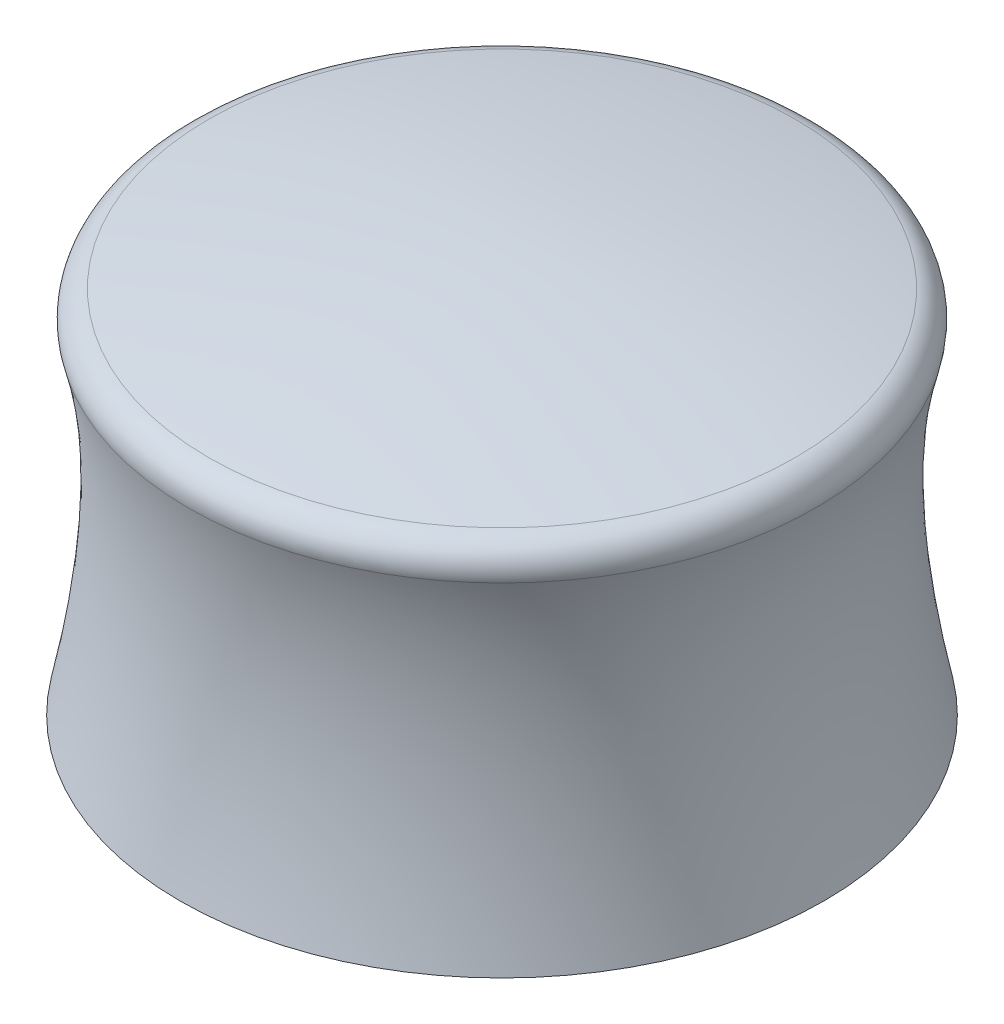
from build123d import *

# Parameters (mm, degrees)
SKETCH1_R           = 10
SKETCH1_R_2         = 3
BOSS_EXTRUDE1_DEPTH = 1
FILLET1_R           = 1
SKETCH4_R           = 3
SKETCH4_R_2         = 2
BOSS_EXTRUDE2_DEPTH = 11
SKETCH4_3_R         = 2
BOSS_EXTRUDE3_DEPTH = 10


with BuildPart() as part:
    # Sketch1 → Boss-Extrude1 (new body)
    with BuildSketch(Plane(origin=(0, 0, 0), x_dir=(1, 0, 0), z_dir=(0, 1, 0))):
        with Locations(Location((0, 0, 0), (0, 0, 270))):
            Circle(SKETCH1_R)
        with Locations(Location((-5.196152423, -3, 0), (0, 0, 270))):
            Circle(SKETCH1_R_2, mode=Mode.SUBTRACT)
        with Locations(Location((0, 6, 0), (0, 0, 270))):
            Circle(SKETCH1_R_2, mode=Mode.SUBTRACT)
        with Locations(Location((5.196152423, -3, 0), (0, 0, 270))):
            Circle(SKETCH1_R_2, mode=Mode.SUBTRACT)
    extrude(amount=-BOSS_EXTRUDE1_DEPTH)

    # Sketch3 → Revolve1 (revolve)
    with BuildSketch(Plane(origin=(0, 0, 0), x_dir=(0, 0, -1), z_dir=(1, 0, 0)), mode=Mode.PRIVATE) as revolve1_sk:
        with BuildLine():
            add(Edge.make_bspline(
                [(9.999996275, -0.564424697), (10.107211142, -0.584912977), (10.365055698, -0.635077572), (10.582841287, -0.679412651), (10.72084613, -0.70837418)],
                knots=[0.694252252, 0.694252252, 0.694252252, 0.694252252, 0.72632335, 0.774744907, 0.774744907, 0.774744907, 0.774744907], degree=3))
            add(Edge.make_bspline(
                [(10.72084613, -0.70837418), (9.43537713, -5.414836401), (10.786099486, -12.52314455)],
                knots=[0.096446407, 0.096446407, 0.096446407, 0.931611687, 0.931611687, 0.931611687], degree=2))
            Line((10.786099486, -12.52314455), (11, -13.5))
            Line((11, -13.5), (12, -13.5))
            add(Edge.make_bspline(
                [(12, 0), (10.187367032, -4.885390543), (12, -13.5)],
                knots=[0, 0, 0, 1, 1, 1], degree=2))
            add(Edge.make_bspline(
                [(0, 1.5), (5.203758478, 1.5), (11.666860381, 0.188025837), (12, 0)],
                knots=[0, 0, 0, 0, 1, 1, 1, 1], degree=3))
            Line((0, 1.5), (0, 0))
            Line((0, 0), (10, 0))
            Line((10, 0), (9.999996275, -0.564424697))
        make_face()
    revolve(revolve1_sk.sketch.rotate(Axis((0, 0, 0), (0, -1, 0)), 180), axis=Axis((0, 0, 0), (0, -1, 0)))

    # Fillet1
    fillet1_edges = [part.edges().sort_by_distance(p)[0] for p in [
        (0, 0, -12),
    ]]
    fillet(fillet1_edges, radius=FILLET1_R)

    # Sketch4 → Boss-Extrude2 (add)
    with BuildSketch(Plane.XZ.offset(1)):
        with Locations(Location((0, 0, 0), (0, 0, 270))):
            Circle(SKETCH4_R)
        with Locations(Location((0, 0, 0), (0, 0, 270))):
            Circle(SKETCH4_R_2, mode=Mode.SUBTRACT)
    extrude(amount=BOSS_EXTRUDE2_DEPTH)

    # Sketch4<3> → Boss-Extrude3 (add)
    with BuildSketch(Plane.XZ.offset(1)):
        with Locations(Location((0, 0, 0), (0, 0, 270))):
            Circle(SKETCH4_3_R)
    extrude(amount=BOSS_EXTRUDE3_DEPTH)


solid = part.part
